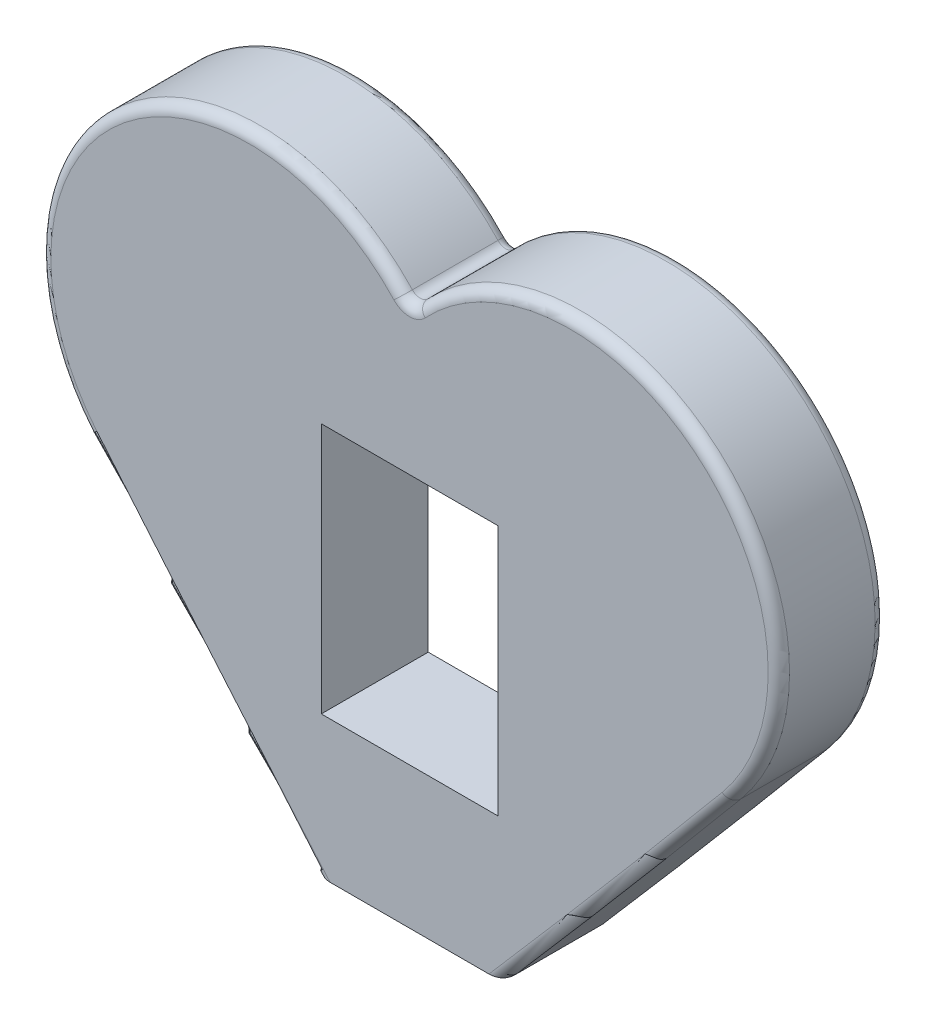
from build123d import *

# Parameters (mm, degrees)
DODANIE_WYCI_GNI_CIE1_DEPTH     = 20
ZAOKR_GLENIE1_R                 = 2
WYTNIJ_WYCI_GNI_CIE1_DEPTH      = 97.32487505
WYTNIJ_WYCI_GNI_CIE1_DEPTH_BACK = 97.32487505
SZKIC4_W                        = 33
SZKIC4_H                        = 47


with BuildPart() as part:
    # Szkic1 → Dodanie-wyciągnięcie1 (new body)
    with BuildSketch(Plane.XY):
        with BuildLine():
            Line((-17.5, -49.947466261), (17.5, -49.947466261))
            ThreePointArc((17.5, -49.947466261), (38.871825844, -25.07740374), (59.999977002, 0))
            ThreePointArc((59.999977002, 0), (55.026266869, 55.026269155), (0, 50.052533739))
            ThreePointArc((0, 50.052533739), (-55.026266869, 55.026269155), (-59.999977002, 0))
            ThreePointArc((-59.999977002, 0), (-38.871825844, -25.07740374), (-17.5, -49.947466261))
        make_face()
    extrude(amount=-DODANIE_WYCI_GNI_CIE1_DEPTH)

    # Zaokrąglenie1
    zaokr_glenie1_edges = [part.edges().sort_by_distance(p)[0] for p in [
        (55.026266869, 55.026269155, -20),
        (38.871825844, -25.07740374, -20),
        (-38.871825844, -25.07740374, -20),
        (38.871825844, -25.07740374, 0),
        (55.026266869, 55.026269155, 0),
        (-55.026266869, 55.026269155, 0),
        (-38.871825844, -25.07740374, 0),
        (-55.026266869, 55.026269155, -20),
        (-17.5, -49.947466261, -10),
        (17.5, -49.947466261, -10),
        (0, 50.052533739, -10),
    ]]
    fillet(zaokr_glenie1_edges, radius=ZAOKR_GLENIE1_R)

    # Szkic4 → Wytnij-wyciągnięcie1 (cut, two sides: drawn at the far end of the back side and taken through both)
    with BuildSketch(Plane.XY.offset(-WYTNIJ_WYCI_GNI_CIE1_DEPTH_BACK)):
        Rectangle(SZKIC4_W, SZKIC4_H)
    extrude(amount=WYTNIJ_WYCI_GNI_CIE1_DEPTH + WYTNIJ_WYCI_GNI_CIE1_DEPTH_BACK, mode=Mode.SUBTRACT)


solid = part.part
